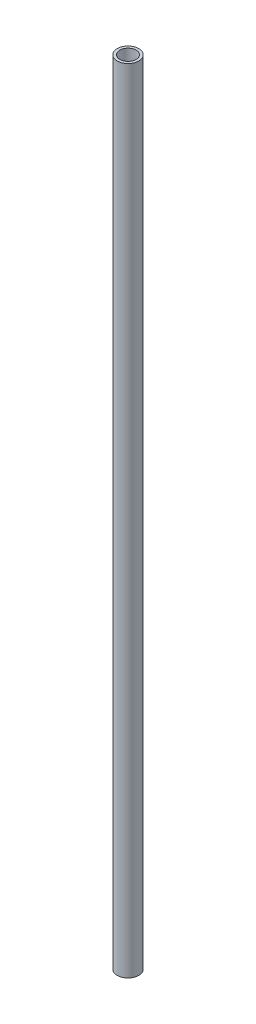
from build123d import *

# Parameters (mm, degrees)
SKETCH1_W = 0.4
SKETCH1_H = 121.4


with BuildPart() as part:
    # Sketch1 → Funda_PTFE (revolve)
    with BuildSketch(Plane.XY, mode=Mode.PRIVATE) as funda_ptfe_sk:
        with Locations((1.45, -99.7)):
            Rectangle(SKETCH1_W, SKETCH1_H)
    revolve(funda_ptfe_sk.sketch.rotate(Axis((0, -164.4, 0), (0, 1, 0)), 90), axis=Axis((0, -164.4, 0), (0, 1, 0)))


solid = part.part
